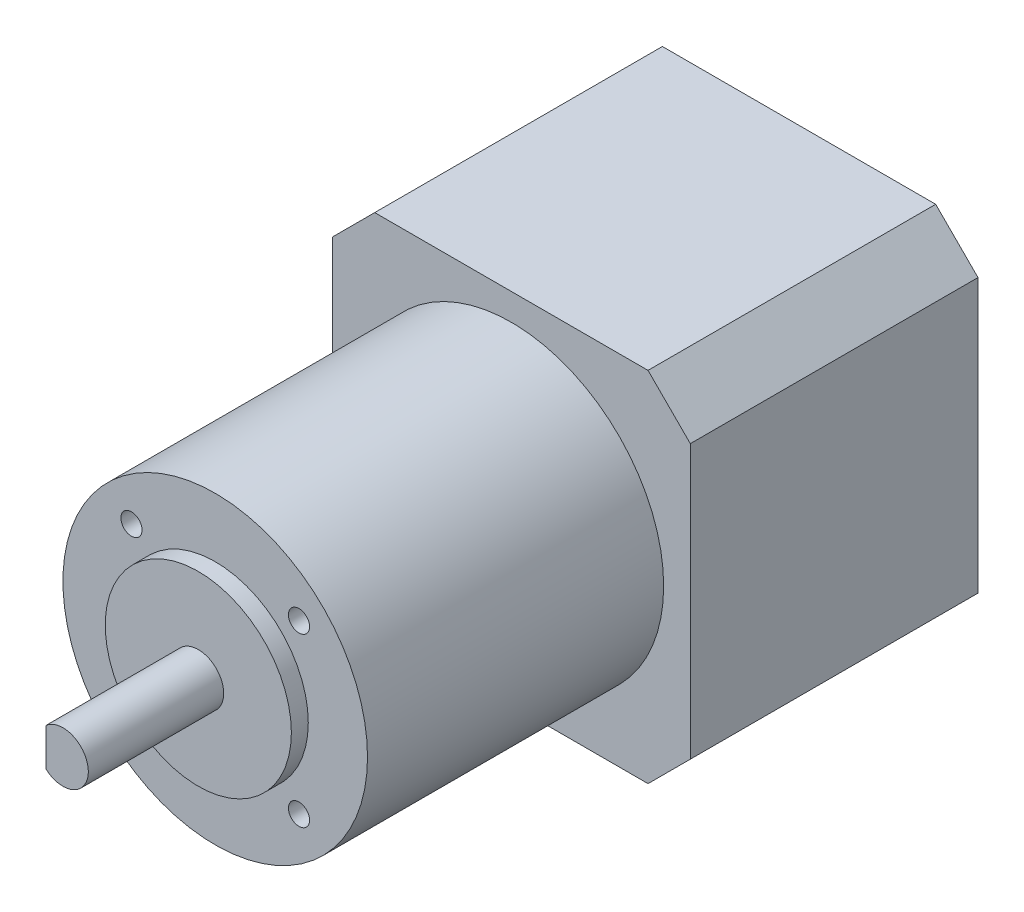
from build123d import *

# Parameters (mm, degrees)
SKETCH1_W                 = 42.3
SKETCH1_H                 = 42.3
BOSS_EXTRUDE1_DEPTH       = 34
SKETCH2_R                 = 18
BOSS_EXTRUDE2_DEPTH       = 35
SKETCH3_R                 = 11
BOSS_EXTRUDE3_DEPTH       = 2
SKETCH4_R                 = 3
BOSS_EXTRUDE4_DEPTH       = 16
CUT_EXTRUDE1_START        = -12
CUT_EXTRUDE1_DEPTH        = 12
CHAMFER1_SIZE             = 5
M3X0_5_TAPPED_HOLE1_D     = 2.5
M3X0_5_TAPPED_HOLE1_DEPTH = 7.5
M3X0_5_TAPPED_HOLE1_TIP   = 0.751075774


with BuildPart() as part:
    # Sketch1 → Boss-Extrude1 (new body)
    with BuildSketch(Plane.XY):
        Rectangle(SKETCH1_W, SKETCH1_H)
    extrude(amount=BOSS_EXTRUDE1_DEPTH)

    # Sketch2 → Boss-Extrude2 (add)
    with BuildSketch(Plane.XY.offset(34)):
        Circle(SKETCH2_R)
    extrude(amount=BOSS_EXTRUDE2_DEPTH)

    # Sketch3 → Boss-Extrude3 (add)
    with BuildSketch(Plane.XY.offset(69)):
        Circle(SKETCH3_R)
    extrude(amount=BOSS_EXTRUDE3_DEPTH)

    # Sketch4 → Boss-Extrude4 (add)
    with BuildSketch(Plane.XY.offset(71)):
        Circle(SKETCH4_R)
    extrude(amount=BOSS_EXTRUDE4_DEPTH)

    # Sketch5 → Cut-Extrude1 (cut)
    with BuildSketch(Plane.XY.offset(87).offset(CUT_EXTRUDE1_START)):
        with BuildLine():
            Line((-2, 2.236067977), (-2, -2.236067977))
            ThreePointArc((-2, -2.236067977), (-3, 0), (-2, 2.236067977))
        make_face()
    extrude(amount=CUT_EXTRUDE1_DEPTH, mode=Mode.SUBTRACT)

    # Chamfer1
    chamfer1_edges = [part.edges().sort_by_distance(p)[0] for p in [
        (-21.15, -21.15, 17),
        (21.15, -21.15, 17),
        (21.15, 21.15, 17),
        (-21.15, 21.15, 17),
    ]]
    chamfer(chamfer1_edges, length=CHAMFER1_SIZE)

    # M3x0.5 Tapped Hole1
    with Locations(Plane.XY.offset(69)):
        with Locations((-9.899494937, 9.899494937), (9.899494937, 9.899494937), (9.899494937, -9.899494937), (-9.899494937, -9.899494937)):
            Hole(M3X0_5_TAPPED_HOLE1_D / 2, depth=M3X0_5_TAPPED_HOLE1_DEPTH)
            with Locations((0, 0, -(M3X0_5_TAPPED_HOLE1_DEPTH + M3X0_5_TAPPED_HOLE1_TIP / 2))):  # 118° drill point
                Cone(0, M3X0_5_TAPPED_HOLE1_D / 2, M3X0_5_TAPPED_HOLE1_TIP, mode=Mode.SUBTRACT)


solid = part.part
